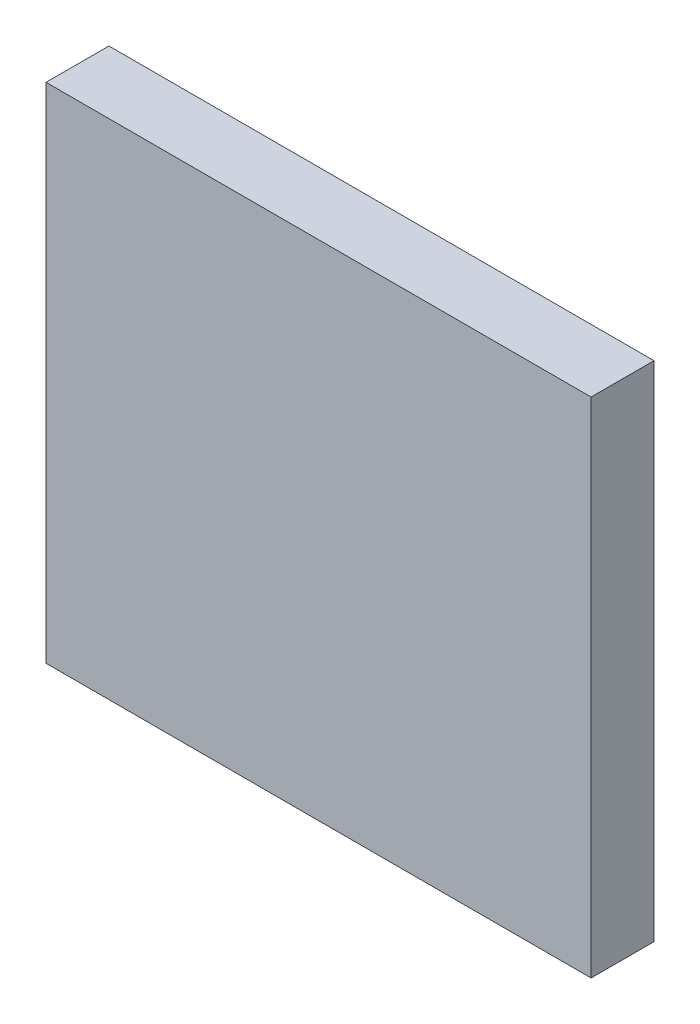
from build123d import *

# Parameters (mm, degrees)
SKETCH_1_W      = 26
SKETCH_1_H      = 24
EXTRUDE_1_DEPTH = 3


with BuildPart() as part:
    # Эскиз1 → Бобышка-Вытянуть1 (new body)
    with BuildSketch(Plane.XY):
        Rectangle(SKETCH_1_W, SKETCH_1_H)
    extrude(amount=EXTRUDE_1_DEPTH)


solid = part.part
